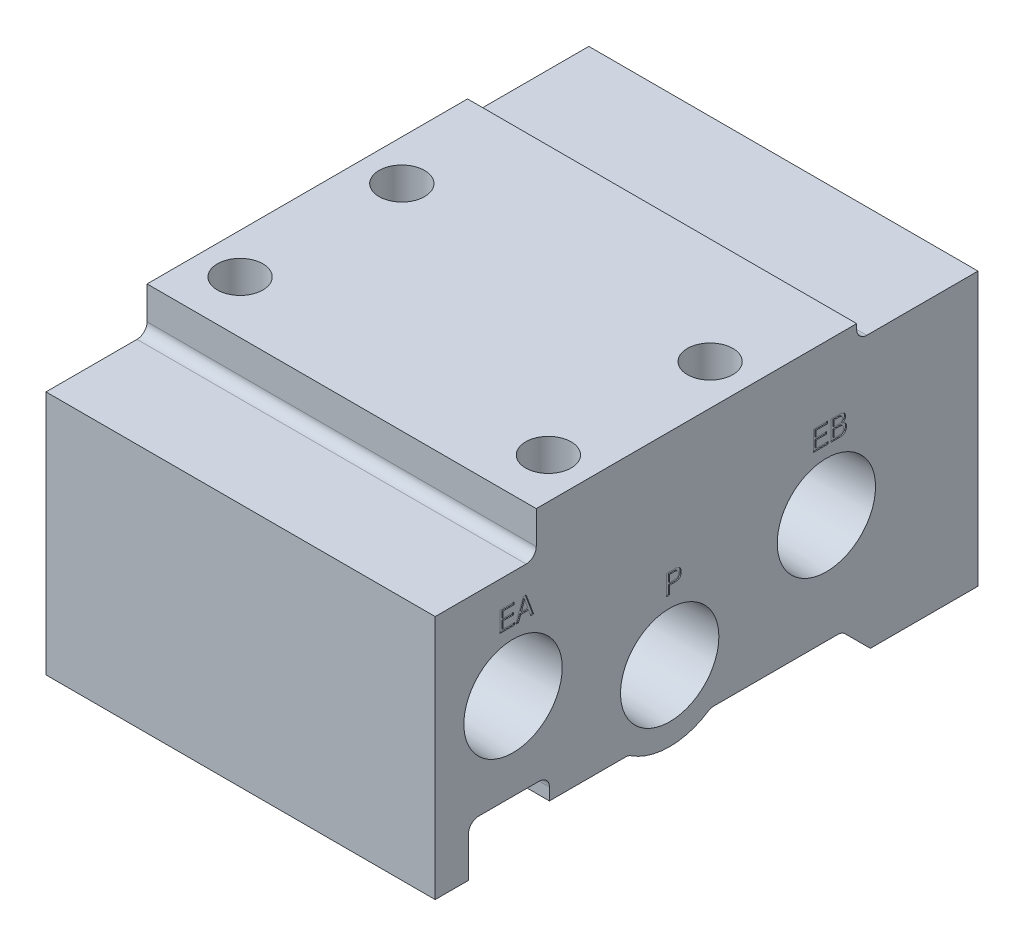
from build123d import *

# Parameters (mm, degrees)
ALUM_EXT_SKETCH_W          = 53.7
ALUM_EXT_SKETCH_H          = 28.5
ALUM_EXT_DEPTH             = 38.5
MGT_HOLES_SKETCH_R         = 2.25
MGT_HOLES_DEPTH            = 55.912862792
TOP_PROFILE_41_SKETCH_W    = 10
TOP_PROFILE_41_SKETCH_H    = 4.25
TOP_PROFILE_41_SKETCH_W_2  = 12
TOP_PROFILE_41_SKETCH_H_2  = 1.5
TOP_PROFILE_41_DEPTH       = 55.912862792
BOTTOM_PROFILE_41_DEPTH    = 55.912862792
ROUNDS_41_R                = 1
PORTS_AT_2_COUNT           = 2
PORTS_AT_2_PITCH           = 16.317475295
PORTS_AT_3_COUNT           = 2
PORTS_AT_3_PITCH           = 16.317475295
PORTS_MIRROR_AT_2_COUNT    = 2
PORTS_MIRROR_AT_2_PITCH    = 16.317475295
PORTS_MIRROR_AT_3_COUNT    = 2
PORTS_MIRROR_AT_3_PITCH    = 31
F_41_42_PORT_LABELS1_DEPTH = 0.1
F_41_42_PORT_LABELS2_DEPTH = 0.1
F_41_42_A_B_LABELS_DEPTH   = 0.1


with BuildPart() as part:
    # Alum Ext Sketch → Alum Ext (new body)
    with BuildSketch(Plane(origin=(0, 0, 0), x_dir=(0, 0, -1), z_dir=(1, 0, 0))):
        with Locations((0, -14.25)):
            Rectangle(ALUM_EXT_SKETCH_W, ALUM_EXT_SKETCH_H)
    extrude(amount=-ALUM_EXT_DEPTH)

    # MGT_Holes Sketch → MGT_Holes (cut, through all)
    with BuildSketch(Plane(origin=(0, 0, 0), x_dir=(1, 0, 0), z_dir=(0, 1, 0))):
        with Locations(Location((-34.5, 4.35, 0), (0, 0, 270))):
            Circle(MGT_HOLES_SKETCH_R)
        with Locations(Location((-34.5, -11.65, 0), (0, 0, 90))):
            Circle(MGT_HOLES_SKETCH_R)
        with Locations(Location((-4, 4.35, 0), (0, 0, 270))):
            Circle(MGT_HOLES_SKETCH_R)
        with Locations(Location((-4, -11.65, 0), (0, 0, 270))):
            Circle(MGT_HOLES_SKETCH_R)
    extrude(amount=-MGT_HOLES_DEPTH, mode=Mode.SUBTRACT)

    # Top_Profile_41 Sketch → Top_Profile_41 (cut, through all)
    with BuildSketch(Plane(origin=(0, 0, 0), x_dir=(0, 0, -1), z_dir=(1, 0, 0))):
        with Locations((-21.85, -2.125)):
            Rectangle(TOP_PROFILE_41_SKETCH_W, TOP_PROFILE_41_SKETCH_H)
        with Locations((20.85, -0.75)):
            Rectangle(TOP_PROFILE_41_SKETCH_W_2, TOP_PROFILE_41_SKETCH_H_2)
    extrude(amount=-TOP_PROFILE_41_DEPTH, mode=Mode.SUBTRACT)

    # Bottom_Profile_41 Sketch → Bottom_Profile_41 (cut, through all)
    with BuildSketch(Plane(origin=(0, 0, 0), x_dir=(0, 0, -1), z_dir=(1, 0, 0))):
        with BuildLine():
            Line((16.2, -28.5), (13.4, -25.7))
            Line((13.4, -25.7), (0.413249931, -25.7))
            ThreePointArc((0.413249931, -25.7), (-3.65, -27), (-7.713249931, -25.7))
            Line((-7.713249931, -25.7), (-15.55, -25.7))
            Line((-15.55, -25.7), (-15.55, -23.5))
            Line((-15.55, -23.5), (-23.55, -23.5))
            Line((-23.55, -23.5), (-23.55, -28.5))
            Line((-23.55, -28.5), (16.2, -28.5))
        make_face()
    extrude(amount=-BOTTOM_PROFILE_41_DEPTH, mode=Mode.SUBTRACT)

    # Rounds_41
    rounds_41_edges = [part.edges().sort_by_distance(p)[0] for p in [
        (-19.25, -4.25, 16.85),
        (-19.25, -1.5, -14.85),
        (-19.25, -25.7, -0.413249931),
        (-19.25, -23.5, 23.55),
        (-19.25, -23.5, 15.55),
        (-19.25, -25.7, 7.713249931),
        (-19.25, -25.7, -13.4),
    ]]
    fillet(rounds_41_edges, radius=ROUNDS_41_R)

    # Ports Profile Sketch → Ports (revolve, cut)
    with BuildSketch(Plane(origin=(0, -20, 3.65), x_dir=(0, 0, -1), z_dir=(0, 1, 0))):
        Polygon((0, 0), (0, 22.45), (3.95, 18.5), (3.95, 7.4), (4.632997004, 7.4), (4.864, 0), align=None)
    ports = revolve(axis=Axis((6.35, -20, 3.65), (-1, 0, 0)), mode=Mode.SUBTRACT)

    # Ports at 2: Ports ×2
    with Locations(*[Vector(0, 0.3125483512508122, -0.9499018518407042) * (i * PORTS_AT_2_PITCH) for i in range(1, PORTS_AT_2_COUNT)]):
        add(ports, mode=Mode.SUBTRACT)

    # Ports at 3: Ports ×2
    with Locations(*[Vector(0, 0.3125483512508122, 0.9499018518407041) * (i * PORTS_AT_3_PITCH) for i in range(1, PORTS_AT_3_COUNT)]):
        add(ports, mode=Mode.SUBTRACT)

    # Ports Mirror Profile Sketch → Ports Mirror (revolve, cut)
    with BuildSketch(Plane(origin=(-38.5, -14.9, -11.85), x_dir=(0, 0, 1), z_dir=(0, 1, 0))):
        Polygon((0, 0), (0, 15.885), (3.95, 11.935), (3.95, 7.4), (4.632997004, 7.4), (4.864, 0), align=None)
    ports_mirror = revolve(axis=Axis((-44.85, -14.9, -11.85), (1, 0, 0)), mode=Mode.SUBTRACT)

    # Ports Mirror at 2: Ports Mirror ×2
    with Locations(*[Vector(0, -0.3125483512508122, 0.9499018518407042) * (i * PORTS_MIRROR_AT_2_PITCH) for i in range(1, PORTS_MIRROR_AT_2_COUNT)]):
        add(ports_mirror, mode=Mode.SUBTRACT)

    # Ports Mirror at 3: Ports Mirror ×2
    with Locations(*[(0, 0, i * PORTS_MIRROR_AT_3_PITCH) for i in range(1, PORTS_MIRROR_AT_3_COUNT)]):
        add(ports_mirror, mode=Mode.SUBTRACT)

    # 41,42 Port Labels1 Sketch → 41,42 Port Labels1 (cut)
    # profile 1 of 5: a face of its own
    with BuildSketch(Plane.ZY.offset(38.5)):
        Polygon((-13.144871795, -8.9), (-13.144871795, -6.9), (-11.731410256, -6.9), (-11.731410256, -7.130769231), (-12.862820513, -7.130769231), (-12.862820513, -7.746153846), (-11.817948718, -7.746153846), (-11.817948718, -7.976923077), (-12.862820513, -7.976923077), (-12.862820513, -8.669230769), (-11.708974359, -8.669230769), (-11.708974359, -8.9), align=None)
    # profile 2 of 5: a face of its own
    with BuildSketch(Plane.ZY.offset(38.5)):
        with BuildLine():
            Line((-11.375641026, -8.9), (-11.375641026, -6.9))
            Line((-11.375641026, -6.9), (-10.582371795, -6.9))
            add(Edge.make_bspline(
                [(-10.582371795, -6.9), (-10.557520601, -6.900391088), (-10.509221677, -6.901151178), (-10.439257463, -6.906808568), (-10.373884128, -6.915794729), (-10.313491954, -6.928977632), (-10.25772712, -6.945607443), (-10.206981233, -6.966644139), (-10.160714162, -6.990826937), (-10.119486132, -7.019131964), (-10.082912178, -7.050918934), (-10.051607199, -7.087006382), (-10.024425363, -7.126312863), (-10.002795087, -7.169699096), (-9.985826511, -7.216613207), (-9.974014126, -7.267309873), (-9.966656438, -7.321659157), (-9.965816477, -7.359110147), (-9.965384615, -7.378365385)],
                knots=[0, 0, 0, 0, 1.338531614, 2.601470082, 3.778553788, 4.890456792, 5.928162005, 6.908738963, 7.84520586, 8.735147048, 9.596633689, 10.447968487, 11.301973765, 12.164180963, 13.051676454, 13.983434255, 14.963192844, 16, 16, 16, 16], degree=3))
            add(Edge.make_bspline(
                [(-9.965384615, -7.378365385), (-9.966331591, -7.402996395), (-9.968168925, -7.450785796), (-9.981718133, -7.519887959), (-10.005663085, -7.582918484), (-10.038410282, -7.640323126), (-10.080645807, -7.691469707), (-10.132507487, -7.735784439), (-10.193110711, -7.77443215), (-10.238424067, -7.793555438), (-10.261858974, -7.803445513)],
                knots=[0, 0, 0, 0, 1.064089938, 2.064560856, 3.027045975, 3.965441717, 4.908263127, 5.877849772, 6.902478258, 8, 8, 8, 8], degree=3))
            add(Edge.make_bspline(
                [(-10.261858974, -7.803445513), (-10.246569522, -7.806518626), (-10.216485798, -7.812565323), (-10.17316555, -7.826052918), (-10.132251748, -7.841956303), (-10.093880076, -7.860736947), (-10.058519403, -7.883036867), (-10.02554128, -7.907811801), (-9.995201163, -7.935720854), (-9.967752142, -7.966578157), (-9.94267115, -7.999705375), (-9.921668464, -8.035541546), (-9.903328698, -8.073092565), (-9.888526343, -8.112963113), (-9.876994446, -8.155075497), (-9.868507088, -8.199259529), (-9.863726514, -8.245513022), (-9.863126284, -8.276992465), (-9.862820513, -8.293028846)],
                knots=[0, 0, 0, 0, 1.079472139, 2.123983387, 3.137357801, 4.117691995, 5.07752268, 6.028353704, 6.970961659, 7.927265266, 8.885490285, 9.843581377, 10.799169054, 11.776706782, 12.784239396, 13.820032524, 14.889472473, 16, 16, 16, 16], degree=3))
            add(Edge.make_bspline(
                [(-9.862820513, -8.293028846), (-9.863272496, -8.315767522), (-9.864153514, -8.360090374), (-9.873541022, -8.424660596), (-9.887061044, -8.485768657), (-9.907353971, -8.543283868), (-9.933566292, -8.597000116), (-9.964872333, -8.647657469), (-10.002489133, -8.694254066), (-10.045355165, -8.737068494), (-10.093055612, -8.775646479), (-10.145401463, -8.808971319), (-10.201906819, -8.836986969), (-10.262136906, -8.860475813), (-10.326816833, -8.877901069), (-10.395416655, -8.890532564), (-10.468116052, -8.898929064), (-10.517977934, -8.899637332), (-10.543509615, -8.9)],
                knots=[0, 0, 0, 0, 1.058427598, 2.063116183, 3.033417234, 3.969927738, 4.896405358, 5.812972495, 6.737861532, 7.679194237, 8.630321786, 9.589794139, 10.563499171, 11.563941868, 12.596215416, 13.678433312, 14.811246201, 16, 16, 16, 16], degree=3))
            Line((-10.543509615, -8.9), (-11.375641026, -8.9))
        make_face()
        with BuildLine():
            Line((-11.093589744, -7.720512821), (-10.638060897, -7.720512821))
            add(Edge.make_bspline(
                [(-10.638060897, -7.720512821), (-10.62189856, -7.72024581), (-10.59060934, -7.719728896), (-10.545208349, -7.716795414), (-10.503095771, -7.710636868), (-10.464283505, -7.702711026), (-10.428663129, -7.693061693), (-10.39684222, -7.679824467), (-10.367793522, -7.665385266), (-10.342235553, -7.64779035), (-10.319629027, -7.628173795), (-10.300015633, -7.605914124), (-10.284162537, -7.580643527), (-10.270210543, -7.55333256), (-10.259923231, -7.523089629), (-10.252860224, -7.490409561), (-10.248348588, -7.45527911), (-10.247747178, -7.430997327), (-10.247435897, -7.418429487)],
                knots=[0, 0, 0, 0, 1.368886017, 2.65007316, 3.849640785, 4.969751217, 6.004381673, 6.968357812, 7.883879336, 8.746530739, 9.588092002, 10.41369514, 11.248159001, 12.107988605, 13.005734059, 13.944160956, 14.935932503, 16, 16, 16, 16], degree=3))
            add(Edge.make_bspline(
                [(-10.247435897, -7.418429487), (-10.24779526, -7.406534873), (-10.248487838, -7.383611119), (-10.252344592, -7.350275069), (-10.259615487, -7.319417291), (-10.2694704, -7.29082689), (-10.28256798, -7.264808482), (-10.298163447, -7.241021057), (-10.316774453, -7.219617856), (-10.338193209, -7.200634591), (-10.362634513, -7.184106045), (-10.389977449, -7.169577213), (-10.420615726, -7.157824898), (-10.454032304, -7.147613488), (-10.490564803, -7.140314754), (-10.529999659, -7.134572338), (-10.572575304, -7.131523238), (-10.60199904, -7.131026383), (-10.617227564, -7.130769231)],
                knots=[0, 0, 0, 0, 1.064043854, 2.05066597, 2.995108535, 3.894129092, 4.74873584, 5.593437176, 6.431611697, 7.277662936, 8.145602371, 9.064553025, 10.040417484, 11.075719197, 12.186014413, 13.368359838, 14.637970495, 16, 16, 16, 16], degree=3))
            Line((-10.617227564, -7.130769231), (-11.093589744, -7.130769231))
            Line((-11.093589744, -7.130769231), (-11.093589744, -7.720512821))
        make_face(mode=Mode.SUBTRACT)
        with BuildLine():
            Line((-11.093589744, -8.669230769), (-10.566746795, -8.669230769))
            add(Edge.make_bspline(
                [(-10.566746795, -8.669230769), (-10.549908372, -8.668922161), (-10.517373227, -8.668325869), (-10.470137599, -8.663774034), (-10.425994956, -8.656854934), (-10.385013028, -8.64634983), (-10.346971081, -8.633180858), (-10.312127837, -8.616877954), (-10.280547117, -8.597345386), (-10.251784041, -8.575352814), (-10.226609275, -8.550046268), (-10.204679995, -8.522071895), (-10.186188284, -8.49137213), (-10.170917321, -8.458069746), (-10.159316799, -8.421991925), (-10.151012013, -8.383343954), (-10.145625468, -8.342058175), (-10.145127121, -8.313612472), (-10.144871795, -8.299038462)],
                knots=[0, 0, 0, 0, 1.261340787, 2.437158505, 3.552412744, 4.605618057, 5.602418951, 6.564726798, 7.481099983, 8.379712099, 9.271165627, 10.147841252, 11.036708081, 11.950072001, 12.886651798, 13.869902527, 14.90865543, 16, 16, 16, 16], degree=3))
            add(Edge.make_bspline(
                [(-10.144871795, -8.299038462), (-10.145117446, -8.284595974), (-10.145594563, -8.256544995), (-10.151054338, -8.215943132), (-10.159140342, -8.17810658), (-10.171288059, -8.143473319), (-10.18652651, -8.111724261), (-10.205588286, -8.083183638), (-10.227647172, -8.057184402), (-10.253710324, -8.034583368), (-10.28331899, -8.01494812), (-10.31638283, -7.997503895), (-10.353598, -7.98333953), (-10.394496601, -7.971081379), (-10.439692519, -7.962804431), (-10.488439021, -7.955798704), (-10.541174333, -7.951838231), (-10.577557944, -7.951471772), (-10.596394231, -7.951282051)],
                knots=[0, 0, 0, 0, 1.058252033, 2.055394168, 2.998523969, 3.890395008, 4.739981298, 5.573732922, 6.40003374, 7.23274972, 8.093659094, 9.000297479, 9.967667442, 11.00874663, 12.12639854, 13.332554366, 14.619027337, 16, 16, 16, 16], degree=3))
            Line((-10.596394231, -7.951282051), (-11.093589744, -7.951282051))
            Line((-11.093589744, -7.951282051), (-11.093589744, -8.669230769))
        make_face(mode=Mode.SUBTRACT)
    # profile 3 of 5: a face of its own
    with BuildSketch(Plane.ZY.offset(38.5)):
        with BuildLine():
            Line((3.355128205, -14), (3.355128205, -12))
            Line((3.355128205, -12), (4.095913462, -12))
            add(Edge.make_bspline(
                [(4.095913462, -12), (4.12409362, -12.000249378), (4.177002091, -12.000717587), (4.250934098, -12.003608091), (4.314154858, -12.009200397), (4.368073681, -12.016451865), (4.415166702, -12.02754219), (4.458606554, -12.040013914), (4.499344903, -12.056098279), (4.524832794, -12.069234093), (4.537419872, -12.075721154)],
                knots=[0, 0, 0, 0, 1.493455121, 2.803973871, 3.919514338, 4.856337602, 5.683863995, 6.481055044, 7.249876038, 8, 8, 8, 8], degree=3))
            add(Edge.make_bspline(
                [(4.537419872, -12.075721154), (4.557109161, -12.087505308), (4.596238242, -12.110924292), (4.646867088, -12.157428597), (4.691435381, -12.210646113), (4.726929673, -12.2725773), (4.756116688, -12.340350372), (4.776198097, -12.414407034), (4.789029685, -12.493809121), (4.790347685, -12.548692188), (4.791025641, -12.576923077)],
                knots=[0, 0, 0, 0, 0.930560885, 1.849329941, 2.778623248, 3.742228717, 4.739438803, 5.770715934, 6.853295292, 8, 8, 8, 8], degree=3))
            add(Edge.make_bspline(
                [(4.791025641, -12.576923077), (4.790347059, -12.603953612), (4.78902587, -12.65658169), (4.776100386, -12.733053307), (4.755916476, -12.804708226), (4.727367087, -12.871331941), (4.690898401, -12.932063622), (4.64652939, -12.986531524), (4.594678687, -13.034755885), (4.555051994, -13.060899771), (4.535016026, -13.07411859)],
                knots=[0, 0, 0, 0, 1.106237948, 2.15382993, 3.166616047, 4.14912887, 5.113446575, 6.058253874, 7.018218259, 8, 8, 8, 8], degree=3))
            add(Edge.make_bspline(
                [(4.535016026, -13.07411859), (4.522597077, -13.081071894), (4.497311506, -13.095229151), (4.456117103, -13.111618603), (4.412179284, -13.125952788), (4.372704814, -13.134789239), (4.337996409, -13.140616309), (4.307779075, -13.144194947), (4.273668896, -13.146691653), (4.235640761, -13.149761537), (4.193551564, -13.151643471), (4.147467197, -13.152726574), (4.097518693, -13.153554018), (4.06292769, -13.153746548), (4.045032051, -13.153846154)],
                knots=[0, 0, 0, 0, 1.018466528, 2.073646265, 3.168741587, 4.32666575, 4.966710573, 5.68928523, 6.505122404, 7.416327688, 8.421864515, 9.522294478, 10.718160255, 12, 12, 12, 12], degree=3))
            Line((4.045032051, -13.153846154), (3.637179487, -13.153846154))
            Line((3.637179487, -13.153846154), (3.637179487, -14))
            Line((3.637179487, -14), (3.355128205, -14))
        make_face()
        with BuildLine():
            Line((3.637179487, -12.923076923), (4.087900641, -12.923076923))
            add(Edge.make_bspline(
                [(4.087900641, -12.923076923), (4.106734424, -12.922848085), (4.142970313, -12.922407806), (4.195182234, -12.919020543), (4.2428652, -12.912380011), (4.286306282, -12.90452837), (4.324991337, -12.892914993), (4.359724875, -12.880257808), (4.389709515, -12.863882812), (4.415997913, -12.84536947), (4.43829063, -12.823331396), (4.457379289, -12.798065143), (4.473409826, -12.769311124), (4.486624477, -12.737183964), (4.496532941, -12.70151272), (4.503634352, -12.662491291), (4.508057153, -12.619891899), (4.508660905, -12.590288992), (4.508974359, -12.574919872)],
                knots=[0, 0, 0, 0, 1.418142734, 2.728483292, 3.935852239, 5.042182902, 6.047730313, 6.973980857, 7.819836916, 8.612371598, 9.387426252, 10.169752478, 10.989196503, 11.859387264, 12.779284547, 13.771317079, 14.842921177, 16, 16, 16, 16], degree=3))
            add(Edge.make_bspline(
                [(4.508974359, -12.574919872), (4.508621001, -12.560087188), (4.507941592, -12.531568007), (4.504041052, -12.490281163), (4.497103925, -12.452223938), (4.486320171, -12.417522781), (4.473955018, -12.385611284), (4.457636989, -12.357322195), (4.43872536, -12.332221086), (4.416721841, -12.31008833), (4.391039013, -12.291246478), (4.361972539, -12.274585285), (4.328843401, -12.261233914), (4.292121529, -12.249962633), (4.251491521, -12.241304691), (4.207065619, -12.234912843), (4.15873708, -12.23141909), (4.125299202, -12.230991373), (4.107932692, -12.230769231)],
                knots=[0, 0, 0, 0, 1.160442503, 2.231212519, 3.241398704, 4.180061104, 5.070566702, 5.91288362, 6.725721963, 7.523583634, 8.344772017, 9.210415603, 10.137847341, 11.13257169, 12.212527806, 13.384203378, 14.64144318, 16, 16, 16, 16], degree=3))
            Line((4.107932692, -12.230769231), (3.637179487, -12.230769231))
            Line((3.637179487, -12.230769231), (3.637179487, -12.923076923))
        make_face(mode=Mode.SUBTRACT)
    # profile 4 of 5: a face of its own
    with BuildSketch(Plane.ZY.offset(38.5)):
        Polygon((17.855128205, -8.9), (17.855128205, -6.9), (19.268589744, -6.9), (19.268589744, -7.130769231), (18.137179487, -7.130769231), (18.137179487, -7.746153846), (19.182051282, -7.746153846), (19.182051282, -7.976923077), (18.137179487, -7.976923077), (18.137179487, -8.669230769), (19.291025641, -8.669230769), (19.291025641, -8.9), align=None)
    # profile 5 of 5: a face of its own
    with BuildSketch(Plane.ZY.offset(38.5)):
        Polygon((19.419230769, -8.9), (20.149198718, -6.9), (20.447676282, -6.9), (21.188461538, -8.9), (20.895592949, -8.9), (20.68525641, -8.31025641), (19.902403846, -8.31025641), (19.690464744, -8.9), align=None)
        Polygon((19.986137821, -8.079487179), (20.605528846, -8.079487179), (20.297836538, -7.188862179), align=None, mode=Mode.SUBTRACT)
    extrude(amount=-F_41_42_PORT_LABELS1_DEPTH, mode=Mode.SUBTRACT)

    # 41,42 Port Labels2 Sketch → 41,42 Port Labels2 (cut)
    # profile 1 of 5: a face of its own
    with BuildSketch(Plane(origin=(0, 0, 0), x_dir=(0, 0, -1), z_dir=(1, 0, 0))):
        Polygon((-20.444871795, -8.9), (-20.444871795, -6.9), (-19.031410256, -6.9), (-19.031410256, -7.130769231), (-20.162820513, -7.130769231), (-20.162820513, -7.746153846), (-19.117948718, -7.746153846), (-19.117948718, -7.976923077), (-20.162820513, -7.976923077), (-20.162820513, -8.669230769), (-19.008974359, -8.669230769), (-19.008974359, -8.9), align=None)
    # profile 2 of 5: a face of its own
    with BuildSketch(Plane(origin=(0, 0, 0), x_dir=(0, 0, -1), z_dir=(1, 0, 0))):
        Polygon((-18.880769231, -8.9), (-18.150801282, -6.9), (-17.852323718, -6.9), (-17.111538462, -8.9), (-17.404407051, -8.9), (-17.61474359, -8.31025641), (-18.397596154, -8.31025641), (-18.609535256, -8.9), align=None)
        Polygon((-18.313862179, -8.079487179), (-17.694471154, -8.079487179), (-18.002163462, -7.188862179), align=None, mode=Mode.SUBTRACT)
    # profile 3 of 5: a face of its own
    with BuildSketch(Plane(origin=(0, 0, 0), x_dir=(0, 0, -1), z_dir=(1, 0, 0))):
        with BuildLine():
            Line((-3.944871795, -14), (-3.944871795, -12))
            Line((-3.944871795, -12), (-3.204086538, -12))
            add(Edge.make_bspline(
                [(-3.204086538, -12), (-3.17590638, -12.000249378), (-3.122997909, -12.000717587), (-3.049065902, -12.003608091), (-2.985845142, -12.009200397), (-2.931926319, -12.016451865), (-2.884833298, -12.02754219), (-2.841393446, -12.040013914), (-2.800655097, -12.056098279), (-2.775167206, -12.069234093), (-2.762580128, -12.075721154)],
                knots=[0, 0, 0, 0, 1.493455121, 2.803973871, 3.919514338, 4.856337602, 5.683863995, 6.481055044, 7.249876038, 8, 8, 8, 8], degree=3))
            add(Edge.make_bspline(
                [(-2.762580128, -12.075721154), (-2.742890839, -12.087505308), (-2.703761758, -12.110924292), (-2.653132912, -12.157428597), (-2.608564619, -12.210646113), (-2.573070327, -12.2725773), (-2.543883312, -12.340350372), (-2.523801903, -12.414407034), (-2.510970315, -12.493809121), (-2.509652315, -12.548692188), (-2.508974359, -12.576923077)],
                knots=[0, 0, 0, 0, 0.930560885, 1.849329941, 2.778623248, 3.742228717, 4.739438803, 5.770715934, 6.853295292, 8, 8, 8, 8], degree=3))
            add(Edge.make_bspline(
                [(-2.508974359, -12.576923077), (-2.509652941, -12.603953612), (-2.51097413, -12.65658169), (-2.523899614, -12.733053307), (-2.544083524, -12.804708226), (-2.572632913, -12.871331941), (-2.609101599, -12.932063622), (-2.65347061, -12.986531524), (-2.705321313, -13.034755885), (-2.744948006, -13.060899771), (-2.764983974, -13.07411859)],
                knots=[0, 0, 0, 0, 1.106237948, 2.15382993, 3.166616047, 4.14912887, 5.113446575, 6.058253874, 7.018218259, 8, 8, 8, 8], degree=3))
            add(Edge.make_bspline(
                [(-2.764983974, -13.07411859), (-2.777402923, -13.081071894), (-2.802688494, -13.095229151), (-2.843882897, -13.111618603), (-2.887820716, -13.125952788), (-2.927295186, -13.134789239), (-2.962003591, -13.140616309), (-2.992220925, -13.144194947), (-3.026331104, -13.146691653), (-3.064359239, -13.149761537), (-3.106448436, -13.151643471), (-3.152532803, -13.152726574), (-3.202481307, -13.153554018), (-3.23707231, -13.153746548), (-3.254967949, -13.153846154)],
                knots=[0, 0, 0, 0, 1.018466528, 2.073646265, 3.168741587, 4.32666575, 4.966710573, 5.68928523, 6.505122404, 7.416327688, 8.421864515, 9.522294478, 10.718160255, 12, 12, 12, 12], degree=3))
            Line((-3.254967949, -13.153846154), (-3.662820513, -13.153846154))
            Line((-3.662820513, -13.153846154), (-3.662820513, -14))
            Line((-3.662820513, -14), (-3.944871795, -14))
        make_face()
        with BuildLine():
            Line((-3.662820513, -12.923076923), (-3.212099359, -12.923076923))
            add(Edge.make_bspline(
                [(-3.212099359, -12.923076923), (-3.193265576, -12.922848085), (-3.157029687, -12.922407806), (-3.104817766, -12.919020543), (-3.0571348, -12.912380011), (-3.013693718, -12.90452837), (-2.975008663, -12.892914993), (-2.940275125, -12.880257808), (-2.910290485, -12.863882812), (-2.884002087, -12.84536947), (-2.86170937, -12.823331396), (-2.842620711, -12.798065143), (-2.826590174, -12.769311124), (-2.813375523, -12.737183964), (-2.803467059, -12.70151272), (-2.796365648, -12.662491291), (-2.791942847, -12.619891899), (-2.791339095, -12.590288992), (-2.791025641, -12.574919872)],
                knots=[0, 0, 0, 0, 1.418142734, 2.728483292, 3.935852239, 5.042182902, 6.047730313, 6.973980857, 7.819836916, 8.612371598, 9.387426252, 10.169752478, 10.989196503, 11.859387264, 12.779284547, 13.771317079, 14.842921177, 16, 16, 16, 16], degree=3))
            add(Edge.make_bspline(
                [(-2.791025641, -12.574919872), (-2.791378999, -12.560087188), (-2.792058408, -12.531568007), (-2.795958948, -12.490281163), (-2.802896075, -12.452223938), (-2.813679829, -12.417522781), (-2.826044982, -12.385611284), (-2.842363011, -12.357322195), (-2.86127464, -12.332221086), (-2.883278159, -12.31008833), (-2.908960987, -12.291246478), (-2.938027461, -12.274585285), (-2.971156599, -12.261233914), (-3.007878471, -12.249962633), (-3.048508479, -12.241304691), (-3.092934381, -12.234912843), (-3.14126292, -12.23141909), (-3.174700798, -12.230991373), (-3.192067308, -12.230769231)],
                knots=[0, 0, 0, 0, 1.160442503, 2.231212519, 3.241398704, 4.180061104, 5.070566702, 5.91288362, 6.725721963, 7.523583634, 8.344772017, 9.210415603, 10.137847341, 11.13257169, 12.212527806, 13.384203378, 14.64144318, 16, 16, 16, 16], degree=3))
            Line((-3.192067308, -12.230769231), (-3.662820513, -12.230769231))
            Line((-3.662820513, -12.230769231), (-3.662820513, -12.923076923))
        make_face(mode=Mode.SUBTRACT)
    # profile 4 of 5: a face of its own
    with BuildSketch(Plane(origin=(0, 0, 0), x_dir=(0, 0, -1), z_dir=(1, 0, 0))):
        Polygon((10.555128205, -8.9), (10.555128205, -6.9), (11.968589744, -6.9), (11.968589744, -7.130769231), (10.837179487, -7.130769231), (10.837179487, -7.746153846), (11.882051282, -7.746153846), (11.882051282, -7.976923077), (10.837179487, -7.976923077), (10.837179487, -8.669230769), (11.991025641, -8.669230769), (11.991025641, -8.9), align=None)
    # profile 5 of 5: a face of its own
    with BuildSketch(Plane(origin=(0, 0, 0), x_dir=(0, 0, -1), z_dir=(1, 0, 0))):
        with BuildLine():
            Line((12.324358974, -8.9), (12.324358974, -6.9))
            Line((12.324358974, -6.9), (13.117628205, -6.9))
            add(Edge.make_bspline(
                [(13.117628205, -6.9), (13.142479399, -6.900391088), (13.190778323, -6.901151178), (13.260742537, -6.906808568), (13.326115872, -6.915794729), (13.386508046, -6.928977632), (13.44227288, -6.945607443), (13.493018767, -6.966644139), (13.539285838, -6.990826937), (13.580513868, -7.019131964), (13.617087822, -7.050918934), (13.648392801, -7.087006382), (13.675574637, -7.126312863), (13.697204913, -7.169699096), (13.714173489, -7.216613207), (13.725985874, -7.267309873), (13.733343562, -7.321659157), (13.734183523, -7.359110147), (13.734615385, -7.378365385)],
                knots=[0, 0, 0, 0, 1.338531614, 2.601470082, 3.778553788, 4.890456792, 5.928162005, 6.908738963, 7.84520586, 8.735147048, 9.596633689, 10.447968487, 11.301973765, 12.164180963, 13.051676454, 13.983434255, 14.963192844, 16, 16, 16, 16], degree=3))
            add(Edge.make_bspline(
                [(13.734615385, -7.378365385), (13.733668409, -7.402996395), (13.731831075, -7.450785796), (13.718281867, -7.519887959), (13.694336915, -7.582918484), (13.661589718, -7.640323126), (13.619354193, -7.691469707), (13.567492513, -7.735784439), (13.506889289, -7.77443215), (13.461575933, -7.793555438), (13.438141026, -7.803445513)],
                knots=[0, 0, 0, 0, 1.064089938, 2.064560856, 3.027045975, 3.965441717, 4.908263127, 5.877849772, 6.902478258, 8, 8, 8, 8], degree=3))
            add(Edge.make_bspline(
                [(13.438141026, -7.803445513), (13.453430478, -7.806518626), (13.483514202, -7.812565323), (13.52683445, -7.826052918), (13.567748252, -7.841956303), (13.606119924, -7.860736947), (13.641480597, -7.883036867), (13.67445872, -7.907811801), (13.704798837, -7.935720854), (13.732247858, -7.966578157), (13.75732885, -7.999705375), (13.778331536, -8.035541546), (13.796671302, -8.073092565), (13.811473657, -8.112963113), (13.823005554, -8.155075497), (13.831492912, -8.199259529), (13.836273486, -8.245513022), (13.836873716, -8.276992465), (13.837179487, -8.293028846)],
                knots=[0, 0, 0, 0, 1.079472139, 2.123983387, 3.137357801, 4.117691995, 5.07752268, 6.028353704, 6.970961659, 7.927265266, 8.885490285, 9.843581377, 10.799169054, 11.776706782, 12.784239396, 13.820032524, 14.889472473, 16, 16, 16, 16], degree=3))
            add(Edge.make_bspline(
                [(13.837179487, -8.293028846), (13.836727504, -8.315767522), (13.835846486, -8.360090374), (13.826458978, -8.424660596), (13.812938956, -8.485768657), (13.792646029, -8.543283868), (13.766433708, -8.597000116), (13.735127667, -8.647657469), (13.697510867, -8.694254066), (13.654644835, -8.737068494), (13.606944388, -8.775646479), (13.554598537, -8.808971319), (13.498093181, -8.836986969), (13.437863094, -8.860475813), (13.373183167, -8.877901069), (13.304583345, -8.890532564), (13.231883948, -8.898929064), (13.182022066, -8.899637332), (13.156490385, -8.9)],
                knots=[0, 0, 0, 0, 1.058427598, 2.063116183, 3.033417234, 3.969927738, 4.896405358, 5.812972495, 6.737861532, 7.679194237, 8.630321786, 9.589794139, 10.563499171, 11.563941868, 12.596215416, 13.678433312, 14.811246201, 16, 16, 16, 16], degree=3))
            Line((13.156490385, -8.9), (12.324358974, -8.9))
        make_face()
        with BuildLine():
            Line((12.606410256, -7.720512821), (13.061939103, -7.720512821))
            add(Edge.make_bspline(
                [(13.061939103, -7.720512821), (13.07810144, -7.72024581), (13.10939066, -7.719728896), (13.154791651, -7.716795414), (13.196904229, -7.710636868), (13.235716495, -7.702711026), (13.271336871, -7.693061693), (13.30315778, -7.679824467), (13.332206478, -7.665385266), (13.357764447, -7.64779035), (13.380370973, -7.628173795), (13.399984367, -7.605914124), (13.415837463, -7.580643527), (13.429789457, -7.55333256), (13.440076769, -7.523089629), (13.447139776, -7.490409561), (13.451651412, -7.45527911), (13.452252822, -7.430997327), (13.452564103, -7.418429487)],
                knots=[0, 0, 0, 0, 1.368886017, 2.65007316, 3.849640785, 4.969751217, 6.004381673, 6.968357812, 7.883879336, 8.746530739, 9.588092002, 10.41369514, 11.248159001, 12.107988605, 13.005734059, 13.944160956, 14.935932503, 16, 16, 16, 16], degree=3))
            add(Edge.make_bspline(
                [(13.452564103, -7.418429487), (13.45220474, -7.406534873), (13.451512162, -7.383611119), (13.447655408, -7.350275069), (13.440384513, -7.319417291), (13.4305296, -7.29082689), (13.41743202, -7.264808482), (13.401836553, -7.241021057), (13.383225547, -7.219617856), (13.361806791, -7.200634591), (13.337365487, -7.184106045), (13.310022551, -7.169577213), (13.279384274, -7.157824898), (13.245967696, -7.147613488), (13.209435197, -7.140314754), (13.170000341, -7.134572338), (13.127424696, -7.131523238), (13.09800096, -7.131026383), (13.082772436, -7.130769231)],
                knots=[0, 0, 0, 0, 1.064043854, 2.05066597, 2.995108535, 3.894129092, 4.74873584, 5.593437176, 6.431611697, 7.277662936, 8.145602371, 9.064553025, 10.040417484, 11.075719197, 12.186014413, 13.368359838, 14.637970495, 16, 16, 16, 16], degree=3))
            Line((13.082772436, -7.130769231), (12.606410256, -7.130769231))
            Line((12.606410256, -7.130769231), (12.606410256, -7.720512821))
        make_face(mode=Mode.SUBTRACT)
        with BuildLine():
            Line((12.606410256, -8.669230769), (13.133253205, -8.669230769))
            add(Edge.make_bspline(
                [(13.133253205, -8.669230769), (13.150091628, -8.668922161), (13.182626773, -8.668325869), (13.229862401, -8.663774034), (13.274005044, -8.656854934), (13.314986972, -8.64634983), (13.353028919, -8.633180858), (13.387872163, -8.616877954), (13.419452883, -8.597345386), (13.448215959, -8.575352814), (13.473390725, -8.550046268), (13.495320005, -8.522071895), (13.513811716, -8.49137213), (13.529082679, -8.458069746), (13.540683201, -8.421991925), (13.548987987, -8.383343954), (13.554374532, -8.342058175), (13.554872879, -8.313612472), (13.555128205, -8.299038462)],
                knots=[0, 0, 0, 0, 1.261340787, 2.437158505, 3.552412744, 4.605618057, 5.602418951, 6.564726798, 7.481099983, 8.379712099, 9.271165627, 10.147841252, 11.036708081, 11.950072001, 12.886651798, 13.869902527, 14.90865543, 16, 16, 16, 16], degree=3))
            add(Edge.make_bspline(
                [(13.555128205, -8.299038462), (13.554882554, -8.284595974), (13.554405437, -8.256544995), (13.548945662, -8.215943132), (13.540859658, -8.17810658), (13.528711941, -8.143473319), (13.51347349, -8.111724261), (13.494411714, -8.083183638), (13.472352828, -8.057184402), (13.446289676, -8.034583368), (13.41668101, -8.01494812), (13.38361717, -7.997503895), (13.346402, -7.98333953), (13.305503399, -7.971081379), (13.260307481, -7.962804431), (13.211560979, -7.955798704), (13.158825667, -7.951838231), (13.122442056, -7.951471772), (13.103605769, -7.951282051)],
                knots=[0, 0, 0, 0, 1.058252033, 2.055394168, 2.998523969, 3.890395008, 4.739981298, 5.573732922, 6.40003374, 7.23274972, 8.093659094, 9.000297479, 9.967667442, 11.00874663, 12.12639854, 13.332554366, 14.619027337, 16, 16, 16, 16], degree=3))
            Line((13.103605769, -7.951282051), (12.606410256, -7.951282051))
            Line((12.606410256, -7.951282051), (12.606410256, -8.669230769))
        make_face(mode=Mode.SUBTRACT)
    extrude(amount=-F_41_42_PORT_LABELS2_DEPTH, mode=Mode.SUBTRACT)

    # 41,42 A,B Labels Sketch → 41,42 A,B Labels (cut)
    # profile 1 of 4: a face of its own
    with BuildSketch(Plane.XY.offset(-26.85)):
        Polygon((-34, -10), (-35.27744391, -6.5), (-35.799779647, -6.5), (-37.096153846, -10), (-36.583633814, -10), (-36.215544872, -8.967948718), (-34.845552885, -8.967948718), (-34.474659455, -10), align=None)
        Polygon((-34.99208734, -8.564102564), (-36.076021635, -8.564102564), (-35.537560096, -7.005508814), align=None, mode=Mode.SUBTRACT)
    # profile 2 of 4: a face of its own
    with BuildSketch(Plane.XY.offset(-26.85)):
        with BuildLine():
            Line((-27.858974359, -23.5), (-27.858974359, -20))
            Line((-27.858974359, -20), (-29.247195513, -20))
            add(Edge.make_bspline(
                [(-29.247195513, -20), (-29.290685102, -20.000684404), (-29.375208219, -20.002014561), (-29.497645593, -20.011914994), (-29.61204893, -20.027640776), (-29.717735234, -20.050710856), (-29.815323694, -20.079813026), (-29.904128997, -20.116627242), (-29.985096371, -20.158947141), (-30.057245422, -20.208480936), (-30.121249843, -20.264108134), (-30.176033556, -20.327261168), (-30.223601769, -20.396047509), (-30.261454752, -20.471973419), (-30.29114976, -20.554073113), (-30.311821433, -20.642792277), (-30.324697388, -20.737903525), (-30.326167319, -20.803442756), (-30.326923077, -20.837139423)],
                knots=[0, 0, 0, 0, 1.338531614, 2.601470082, 3.778553788, 4.890456792, 5.928162005, 6.908738963, 7.84520586, 8.735147048, 9.596633689, 10.447968487, 11.301973765, 12.164180963, 13.051676454, 13.983434255, 14.963192844, 16, 16, 16, 16], degree=3))
            add(Edge.make_bspline(
                [(-30.326923077, -20.837139423), (-30.32526587, -20.880243692), (-30.322050535, -20.963875144), (-30.29833942, -21.084803928), (-30.256435755, -21.195107347), (-30.199128161, -21.295565471), (-30.125215992, -21.385071987), (-30.034458052, -21.462622768), (-29.928402409, -21.530256263), (-29.849104036, -21.563722017), (-29.808092949, -21.581029647)],
                knots=[0, 0, 0, 0, 1.064089938, 2.064560856, 3.027045975, 3.965441717, 4.908263127, 5.877849772, 6.902478258, 8, 8, 8, 8], degree=3))
            add(Edge.make_bspline(
                [(-29.808092949, -21.581029647), (-29.83484949, -21.586407596), (-29.887496008, -21.596989316), (-29.963306442, -21.620592607), (-30.034905595, -21.648423531), (-30.102056021, -21.681289657), (-30.163937199, -21.720314518), (-30.221648914, -21.763670652), (-30.274744119, -21.812511494), (-30.322779905, -21.866511775), (-30.366671641, -21.924484406), (-30.403426342, -21.987197706), (-30.435520932, -22.052911989), (-30.461425053, -22.122685447), (-30.481605873, -22.196382119), (-30.49645875, -22.273704176), (-30.504824755, -22.354647789), (-30.505875157, -22.409736815), (-30.506410256, -22.437800481)],
                knots=[0, 0, 0, 0, 1.079472139, 2.123983387, 3.137357801, 4.117691995, 5.07752268, 6.028353704, 6.970961659, 7.927265266, 8.885490285, 9.843581377, 10.799169054, 11.776706782, 12.784239396, 13.820032524, 14.889472473, 16, 16, 16, 16], degree=3))
            add(Edge.make_bspline(
                [(-30.506410256, -22.437800481), (-30.505619286, -22.477593164), (-30.504077505, -22.555158155), (-30.487649365, -22.668156042), (-30.463989327, -22.77509515), (-30.428476704, -22.875746769), (-30.382605143, -22.969750203), (-30.327819571, -23.058400571), (-30.261990171, -23.139944616), (-30.186974614, -23.214869865), (-30.103498834, -23.282381338), (-30.011893594, -23.340699808), (-29.91300922, -23.389727196), (-29.807606568, -23.430832673), (-29.694416695, -23.461326871), (-29.574367008, -23.483431987), (-29.447143063, -23.498125862), (-29.35988477, -23.499365332), (-29.315204327, -23.5)],
                knots=[0, 0, 0, 0, 1.058427598, 2.063116183, 3.033417234, 3.969927738, 4.896405358, 5.812972495, 6.737861532, 7.679194237, 8.630321786, 9.589794139, 10.563499171, 11.563941868, 12.596215416, 13.678433312, 14.811246201, 16, 16, 16, 16], degree=3))
            Line((-29.315204327, -23.5), (-27.858974359, -23.5))
        make_face()
        with BuildLine():
            Line((-28.352564103, -21.435897436), (-29.149739583, -21.435897436))
            add(Edge.make_bspline(
                [(-29.149739583, -21.435897436), (-29.178023674, -21.435430168), (-29.23277981, -21.434525568), (-29.312231542, -21.429391974), (-29.385928555, -21.418614519), (-29.453850021, -21.404744295), (-29.516185678, -21.387857963), (-29.571872268, -21.364692817), (-29.62270749, -21.339424215), (-29.667433937, -21.308633112), (-29.706995357, -21.274304141), (-29.741318795, -21.235349716), (-29.769061713, -21.191126172), (-29.793477703, -21.143331981), (-29.8114805, -21.09040685), (-29.823840762, -21.033216732), (-29.831736124, -20.971738443), (-29.832788593, -20.929245323), (-29.833333333, -20.907251603)],
                knots=[0, 0, 0, 0, 1.368886017, 2.65007316, 3.849640785, 4.969751217, 6.004381673, 6.968357812, 7.883879336, 8.746530739, 9.588092002, 10.41369514, 11.248159001, 12.107988605, 13.005734059, 13.944160956, 14.935932503, 16, 16, 16, 16], degree=3))
            add(Edge.make_bspline(
                [(-29.833333333, -20.907251603), (-29.832704448, -20.886436029), (-29.831492437, -20.846319459), (-29.824743118, -20.78798137), (-29.812019051, -20.733980259), (-29.794772954, -20.683947058), (-29.771852189, -20.638414843), (-29.744560122, -20.59678685), (-29.711990861, -20.559331249), (-29.674508037, -20.526110534), (-29.631735756, -20.497185578), (-29.583885618, -20.471760122), (-29.530268633, -20.451193571), (-29.471789621, -20.433323604), (-29.407857749, -20.42055082), (-29.33884675, -20.410501592), (-29.264339373, -20.405165666), (-29.212847835, -20.40429617), (-29.186197917, -20.403846154)],
                knots=[0, 0, 0, 0, 1.064043854, 2.05066597, 2.995108535, 3.894129092, 4.74873584, 5.593437176, 6.431611697, 7.277662936, 8.145602371, 9.064553025, 10.040417484, 11.075719197, 12.186014413, 13.368359838, 14.637970495, 16, 16, 16, 16], degree=3))
            Line((-29.186197917, -20.403846154), (-28.352564103, -20.403846154))
            Line((-28.352564103, -20.403846154), (-28.352564103, -21.435897436))
        make_face(mode=Mode.SUBTRACT)
        with BuildLine():
            Line((-28.352564103, -23.096153846), (-29.274539263, -23.096153846))
            add(Edge.make_bspline(
                [(-29.274539263, -23.096153846), (-29.304006503, -23.095613782), (-29.360943007, -23.094570271), (-29.443605356, -23.086604559), (-29.520854981, -23.074496135), (-29.592573355, -23.056112202), (-29.659146761, -23.033066501), (-29.720122439, -23.004536419), (-29.775388699, -22.970354426), (-29.825724082, -22.931867424), (-29.869779923, -22.88758097), (-29.908156162, -22.838625817), (-29.940516657, -22.784901228), (-29.967240842, -22.726622055), (-29.987541756, -22.663485868), (-30.002075131, -22.595851919), (-30.011501585, -22.523601806), (-30.012373693, -22.473821826), (-30.012820513, -22.448317308)],
                knots=[0, 0, 0, 0, 1.261340787, 2.437158505, 3.552412744, 4.605618057, 5.602418951, 6.564726798, 7.481099983, 8.379712099, 9.271165627, 10.147841252, 11.036708081, 11.950072001, 12.886651798, 13.869902527, 14.90865543, 16, 16, 16, 16], degree=3))
            add(Edge.make_bspline(
                [(-30.012820513, -22.448317308), (-30.012390624, -22.423042954), (-30.011555669, -22.373953741), (-30.002001063, -22.30290048), (-29.987850556, -22.236686515), (-29.966592051, -22.176078308), (-29.939924762, -22.120517457), (-29.906566653, -22.070571367), (-29.867963603, -22.025072704), (-29.822353087, -21.985520894), (-29.770537921, -21.95115921), (-29.712676202, -21.920631816), (-29.647549654, -21.895844178), (-29.575977103, -21.874392413), (-29.496884246, -21.859907754), (-29.411577868, -21.847647732), (-29.319291071, -21.840716904), (-29.255619752, -21.840075601), (-29.22265625, -21.83974359)],
                knots=[0, 0, 0, 0, 1.058252033, 2.055394168, 2.998523969, 3.890395008, 4.739981298, 5.573732922, 6.40003374, 7.23274972, 8.093659094, 9.000297479, 9.967667442, 11.00874663, 12.12639854, 13.332554366, 14.619027337, 16, 16, 16, 16], degree=3))
            Line((-29.22265625, -21.83974359), (-28.352564103, -21.83974359))
            Line((-28.352564103, -21.83974359), (-28.352564103, -23.096153846))
        make_face(mode=Mode.SUBTRACT)
    # profile 3 of 4: a face of its own
    with BuildSketch(Plane.XY.offset(-26.85)):
        Polygon((-8, -10), (-9.27744391, -6.5), (-9.799779647, -6.5), (-11.096153846, -10), (-10.583633814, -10), (-10.215544872, -8.967948718), (-8.845552885, -8.967948718), (-8.474659455, -10), align=None)
        Polygon((-8.99208734, -8.564102564), (-10.076021635, -8.564102564), (-9.537560096, -7.005508814), align=None, mode=Mode.SUBTRACT)
    # profile 4 of 4: a face of its own
    with BuildSketch(Plane.XY.offset(-26.85)):
        with BuildLine():
            Line((-1.358974359, -23.5), (-1.358974359, -20))
            Line((-1.358974359, -20), (-2.747195513, -20))
            add(Edge.make_bspline(
                [(-2.747195513, -20), (-2.790685102, -20.000684404), (-2.875208219, -20.002014561), (-2.997645593, -20.011914994), (-3.11204893, -20.027640776), (-3.217735234, -20.050710856), (-3.315323694, -20.079813026), (-3.404128997, -20.116627242), (-3.485096371, -20.158947141), (-3.557245422, -20.208480936), (-3.621249843, -20.264108134), (-3.676033556, -20.327261168), (-3.723601769, -20.396047509), (-3.761454752, -20.471973419), (-3.79114976, -20.554073113), (-3.811821433, -20.642792277), (-3.824697388, -20.737903525), (-3.826167319, -20.803442756), (-3.826923077, -20.837139423)],
                knots=[0, 0, 0, 0, 1.338531614, 2.601470082, 3.778553788, 4.890456792, 5.928162005, 6.908738963, 7.84520586, 8.735147048, 9.596633689, 10.447968487, 11.301973765, 12.164180963, 13.051676454, 13.983434255, 14.963192844, 16, 16, 16, 16], degree=3))
            add(Edge.make_bspline(
                [(-3.826923077, -20.837139423), (-3.82526587, -20.880243692), (-3.822050535, -20.963875144), (-3.79833942, -21.084803928), (-3.756435755, -21.195107347), (-3.699128161, -21.295565471), (-3.625215992, -21.385071987), (-3.534458052, -21.462622768), (-3.428402409, -21.530256263), (-3.349104036, -21.563722017), (-3.308092949, -21.581029647)],
                knots=[0, 0, 0, 0, 1.064089938, 2.064560856, 3.027045975, 3.965441717, 4.908263127, 5.877849772, 6.902478258, 8, 8, 8, 8], degree=3))
            add(Edge.make_bspline(
                [(-3.308092949, -21.581029647), (-3.33484949, -21.586407596), (-3.387496008, -21.596989316), (-3.463306442, -21.620592607), (-3.534905595, -21.648423531), (-3.602056021, -21.681289657), (-3.663937199, -21.720314518), (-3.721648914, -21.763670652), (-3.774744119, -21.812511494), (-3.822779905, -21.866511775), (-3.866671641, -21.924484406), (-3.903426342, -21.987197706), (-3.935520932, -22.052911989), (-3.961425053, -22.122685447), (-3.981605873, -22.196382119), (-3.99645875, -22.273704176), (-4.004824755, -22.354647789), (-4.005875157, -22.409736815), (-4.006410256, -22.437800481)],
                knots=[0, 0, 0, 0, 1.079472139, 2.123983387, 3.137357801, 4.117691995, 5.07752268, 6.028353704, 6.970961659, 7.927265266, 8.885490285, 9.843581377, 10.799169054, 11.776706782, 12.784239396, 13.820032524, 14.889472473, 16, 16, 16, 16], degree=3))
            add(Edge.make_bspline(
                [(-4.006410256, -22.437800481), (-4.005619286, -22.477593164), (-4.004077505, -22.555158155), (-3.987649365, -22.668156042), (-3.963989327, -22.77509515), (-3.928476704, -22.875746769), (-3.882605143, -22.969750203), (-3.827819571, -23.058400571), (-3.761990171, -23.139944616), (-3.686974614, -23.214869865), (-3.603498834, -23.282381338), (-3.511893594, -23.340699808), (-3.41300922, -23.389727196), (-3.307606568, -23.430832673), (-3.194416695, -23.461326871), (-3.074367008, -23.483431987), (-2.947143063, -23.498125862), (-2.85988477, -23.499365332), (-2.815204327, -23.5)],
                knots=[0, 0, 0, 0, 1.058427598, 2.063116183, 3.033417234, 3.969927738, 4.896405358, 5.812972495, 6.737861532, 7.679194237, 8.630321786, 9.589794139, 10.563499171, 11.563941868, 12.596215416, 13.678433312, 14.811246201, 16, 16, 16, 16], degree=3))
            Line((-2.815204327, -23.5), (-1.358974359, -23.5))
        make_face()
        with BuildLine():
            Line((-1.852564103, -21.435897436), (-2.649739583, -21.435897436))
            add(Edge.make_bspline(
                [(-2.649739583, -21.435897436), (-2.678023674, -21.435430168), (-2.73277981, -21.434525568), (-2.812231542, -21.429391974), (-2.885928555, -21.418614519), (-2.953850021, -21.404744295), (-3.016185678, -21.387857963), (-3.071872268, -21.364692817), (-3.12270749, -21.339424215), (-3.167433937, -21.308633112), (-3.206995357, -21.274304141), (-3.241318795, -21.235349716), (-3.269061713, -21.191126172), (-3.293477703, -21.143331981), (-3.3114805, -21.09040685), (-3.323840762, -21.033216732), (-3.331736124, -20.971738443), (-3.332788593, -20.929245323), (-3.333333333, -20.907251603)],
                knots=[0, 0, 0, 0, 1.368886017, 2.65007316, 3.849640785, 4.969751217, 6.004381673, 6.968357812, 7.883879336, 8.746530739, 9.588092002, 10.41369514, 11.248159001, 12.107988605, 13.005734059, 13.944160956, 14.935932503, 16, 16, 16, 16], degree=3))
            add(Edge.make_bspline(
                [(-3.333333333, -20.907251603), (-3.332704448, -20.886436029), (-3.331492437, -20.846319459), (-3.324743118, -20.78798137), (-3.312019051, -20.733980259), (-3.294772954, -20.683947058), (-3.271852189, -20.638414843), (-3.244560122, -20.59678685), (-3.211990861, -20.559331249), (-3.174508037, -20.526110534), (-3.131735756, -20.497185578), (-3.083885618, -20.471760122), (-3.030268633, -20.451193571), (-2.971789621, -20.433323604), (-2.907857749, -20.42055082), (-2.83884675, -20.410501592), (-2.764339373, -20.405165666), (-2.712847835, -20.40429617), (-2.686197917, -20.403846154)],
                knots=[0, 0, 0, 0, 1.064043854, 2.05066597, 2.995108535, 3.894129092, 4.74873584, 5.593437176, 6.431611697, 7.277662936, 8.145602371, 9.064553025, 10.040417484, 11.075719197, 12.186014413, 13.368359838, 14.637970495, 16, 16, 16, 16], degree=3))
            Line((-2.686197917, -20.403846154), (-1.852564103, -20.403846154))
            Line((-1.852564103, -20.403846154), (-1.852564103, -21.435897436))
        make_face(mode=Mode.SUBTRACT)
        with BuildLine():
            Line((-1.852564103, -23.096153846), (-2.774539263, -23.096153846))
            add(Edge.make_bspline(
                [(-2.774539263, -23.096153846), (-2.804006503, -23.095613782), (-2.860943007, -23.094570271), (-2.943605356, -23.086604559), (-3.020854981, -23.074496135), (-3.092573355, -23.056112202), (-3.159146761, -23.033066501), (-3.220122439, -23.004536419), (-3.275388699, -22.970354426), (-3.325724082, -22.931867424), (-3.369779923, -22.88758097), (-3.408156162, -22.838625817), (-3.440516657, -22.784901228), (-3.467240842, -22.726622055), (-3.487541756, -22.663485868), (-3.502075131, -22.595851919), (-3.511501585, -22.523601806), (-3.512373693, -22.473821826), (-3.512820513, -22.448317308)],
                knots=[0, 0, 0, 0, 1.261340787, 2.437158505, 3.552412744, 4.605618057, 5.602418951, 6.564726798, 7.481099983, 8.379712099, 9.271165627, 10.147841252, 11.036708081, 11.950072001, 12.886651798, 13.869902527, 14.90865543, 16, 16, 16, 16], degree=3))
            add(Edge.make_bspline(
                [(-3.512820513, -22.448317308), (-3.512390624, -22.423042954), (-3.511555669, -22.373953741), (-3.502001063, -22.30290048), (-3.487850556, -22.236686515), (-3.466592051, -22.176078308), (-3.439924762, -22.120517457), (-3.406566653, -22.070571367), (-3.367963603, -22.025072704), (-3.322353087, -21.985520894), (-3.270537921, -21.95115921), (-3.212676202, -21.920631816), (-3.147549654, -21.895844178), (-3.075977103, -21.874392413), (-2.996884246, -21.859907754), (-2.911577868, -21.847647732), (-2.819291071, -21.840716904), (-2.755619752, -21.840075601), (-2.72265625, -21.83974359)],
                knots=[0, 0, 0, 0, 1.058252033, 2.055394168, 2.998523969, 3.890395008, 4.739981298, 5.573732922, 6.40003374, 7.23274972, 8.093659094, 9.000297479, 9.967667442, 11.00874663, 12.12639854, 13.332554366, 14.619027337, 16, 16, 16, 16], degree=3))
            Line((-2.72265625, -21.83974359), (-1.852564103, -21.83974359))
            Line((-1.852564103, -21.83974359), (-1.852564103, -23.096153846))
        make_face(mode=Mode.SUBTRACT)
    extrude(amount=F_41_42_A_B_LABELS_DEPTH, mode=Mode.SUBTRACT)


solid = part.part
